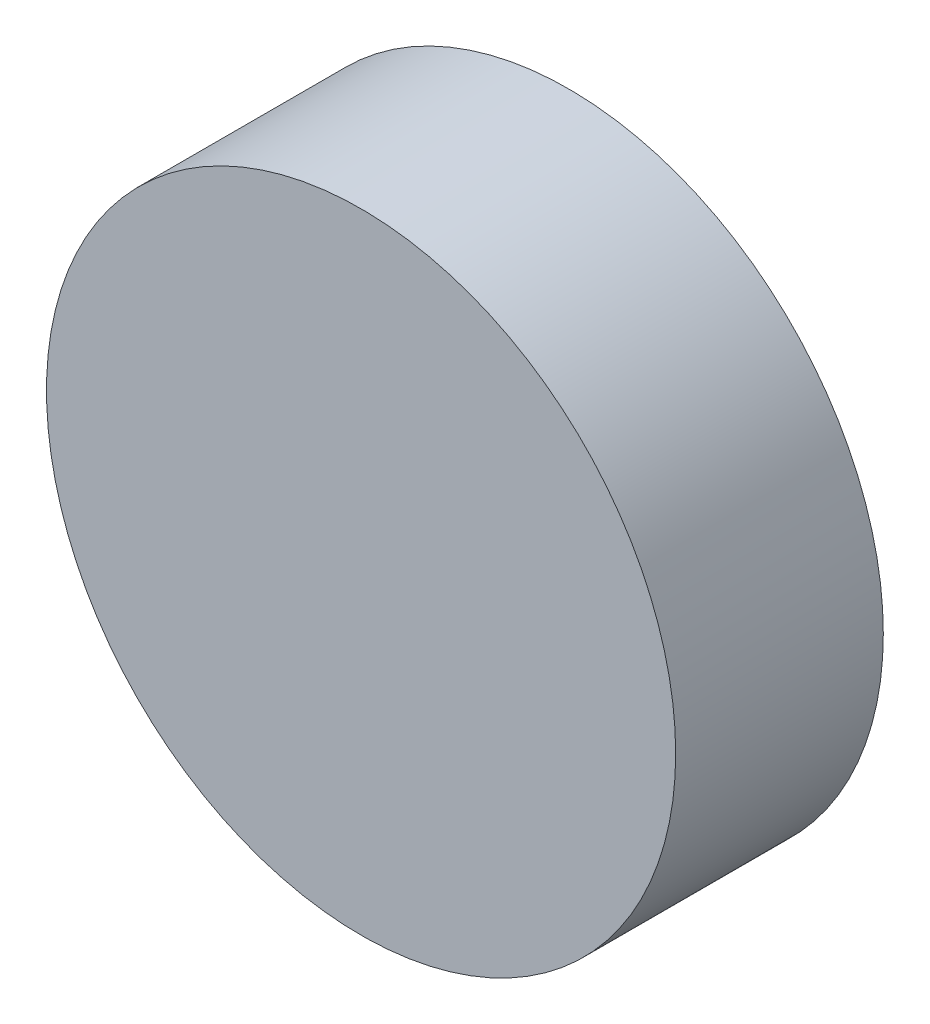
from build123d import *

# Parameters (mm, degrees)
SKETCH_1_R      = 5
EXTRUDE_1_DEPTH = 1.65


with BuildPart() as part:
    # ｽｹｯﾁ1 → ﾎﾞｽ - 押し出し1 (new, symmetric)
    with BuildSketch(Plane.XY):
        Circle(SKETCH_1_R)
    extrude(amount=EXTRUDE_1_DEPTH, both=True)


solid = part.part
